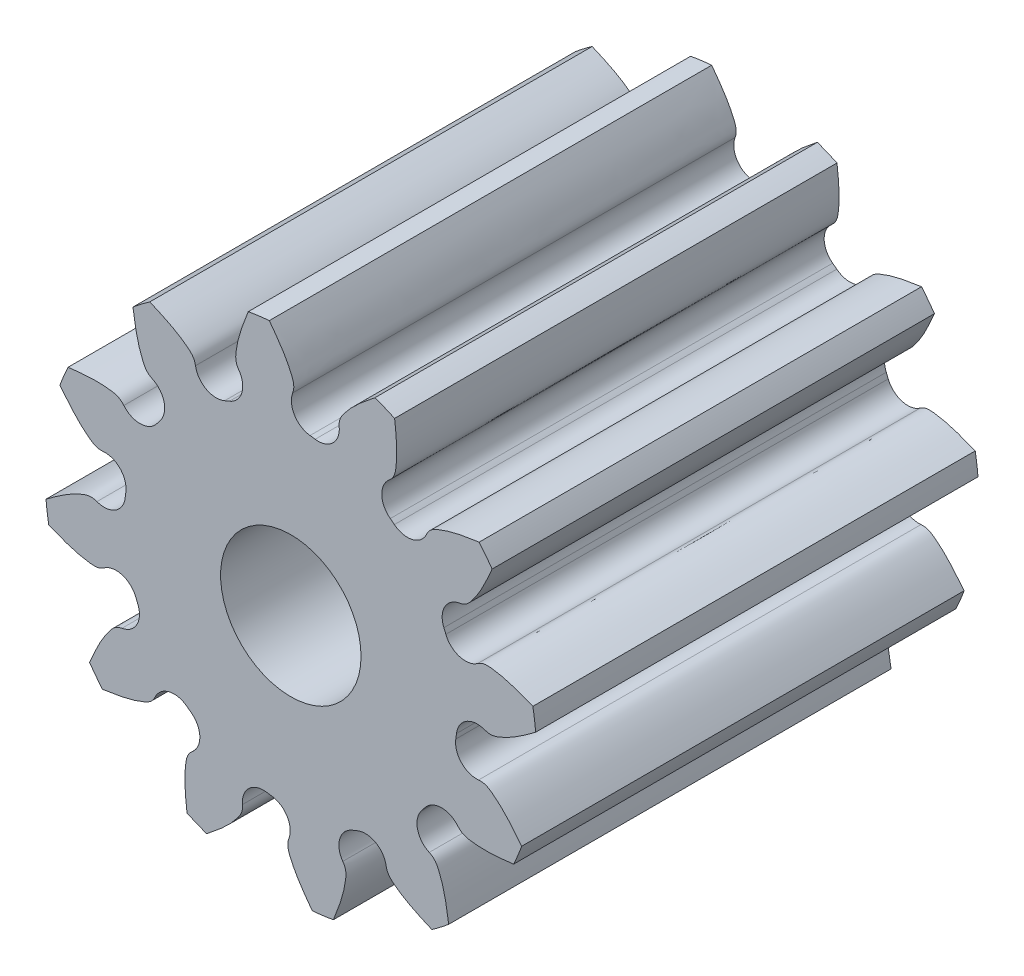
from build123d import *

# Parameters (mm, degrees)
ESQUISSE1_R                        = 2.375
BASE_EXTRUSION_DEPTH               = 6.3
BOSS_EXTRU_1_DEPTH                 = 6.3
CONG_1_R                           = 0.3
R_P_TITION_CIRCULAIRE1_COUNT       = 12
CONG_1_OF_R_P_TITION_CIRCULAIRE1_R = 0.3
ESQUISSE3_R                        = 1
ENL_V_MAT_EXTRU_2_DEPTH            = 9.000154745


with BuildPart() as part:
    # Esquisse1 → Base-Extrusion (new body)
    with BuildSketch(Plane.XY):
        Circle(ESQUISSE1_R)
    extrude(amount=BASE_EXTRUSION_DEPTH)

    # Esquisse2 → Boss.-Extru.1 (add)
    with BuildSketch(Plane.XY):
        with BuildLine():
            Line((2.339110451, 0.411323835), (2.365893236, 0.207784014))
            add(Edge.make_bspline(
                [(2.365893236, 0.207784014), (2.397666462, 0.194705314), (2.56405268, 0.126216344), (2.752522526, -0.095560613), (3.140622195, 0.049124103), (3.334378301, 0.193105969), (3.486579505, 0.306208021)],
                knots=[0, 0, 0, 0, 0.081431974, 0.426433181, 0.549446145, 1, 1, 1, 1], degree=3))
            ThreePointArc((3.486579505, 0.306208021), (3.470087324, 0.456611396), (3.447110139, 0.606161441))
            add(Edge.make_bspline(
                [(2.339110451, 0.411323835), (2.366418782, 0.432176782), (2.509423772, 0.541376989), (2.634106469, 0.804360119), (3.046423901, 0.764998278), (3.270831372, 0.676040461), (3.447110139, 0.606161441)],
                knots=[0, 0, 0, 0, 0.081431974, 0.426433181, 0.549446145, 1, 1, 1, 1], degree=3))
        make_face()
    boss_extru_1 = extrude(amount=BOSS_EXTRU_1_DEPTH)

    # Congé1
    cong_1_edges = [part.edges().sort_by_distance(p)[0] for p in [
        (2.365893236, 0.207784014, 3.15),
        (2.339110451, 0.411323835, 3.15),
    ]]
    fillet(cong_1_edges, radius=CONG_1_R)

    # Répétition circulaire1: Boss.-Extru.1 ×12 about axis
    r_p_tition_circulaire1_axis = Axis((0, 0, -50), (0, 0, 1))
    for i in range(1, R_P_TITION_CIRCULAIRE1_COUNT):
        add(boss_extru_1.rotate(r_p_tition_circulaire1_axis, i * 360 / R_P_TITION_CIRCULAIRE1_COUNT))

    # Congé1 of Répétition circulaire1
    cong_1_of_r_p_tition_circulaire1_edges = [part.edges().sort_by_distance(p)[0] for p in [
        (1.945031638, 1.362892853, 3.15),
        (1.820067156, 1.525772116, 3.15),
        (1.003000383, 2.152815652, 3.15),
        (0.813338335, 2.23139099, 3.15),
        (-0.207784014, 2.365893236, 3.15),
        (-0.411323835, 2.339110451, 3.15),
        (-1.362892853, 1.945031638, 3.15),
        (-1.525772116, 1.820067156, 3.15),
        (-2.152815652, 1.003000383, 3.15),
        (-2.23139099, 0.813338335, 3.15),
        (-2.365893236, -0.207784014, 3.15),
        (-2.339110451, -0.411323835, 3.15),
        (-1.945031638, -1.362892853, 3.15),
        (-1.820067156, -1.525772116, 3.15),
        (-1.003000383, -2.152815652, 3.15),
        (-0.813338335, -2.23139099, 3.15),
        (0.207784014, -2.365893236, 3.15),
        (0.411323835, -2.339110451, 3.15),
        (1.362892853, -1.945031638, 3.15),
        (1.525772116, -1.820067156, 3.15),
        (2.152815652, -1.003000383, 3.15),
        (2.23139099, -0.813338335, 3.15),
    ]]
    fillet(cong_1_of_r_p_tition_circulaire1_edges, radius=CONG_1_OF_R_P_TITION_CIRCULAIRE1_R)

    # Esquisse3 → Enlèv. mat.-Extru.2 (cut, through all)
    with BuildSketch(Plane.XY):
        Circle(ESQUISSE3_R)
    extrude(amount=ENL_V_MAT_EXTRU_2_DEPTH, mode=Mode.SUBTRACT)


solid = part.part
